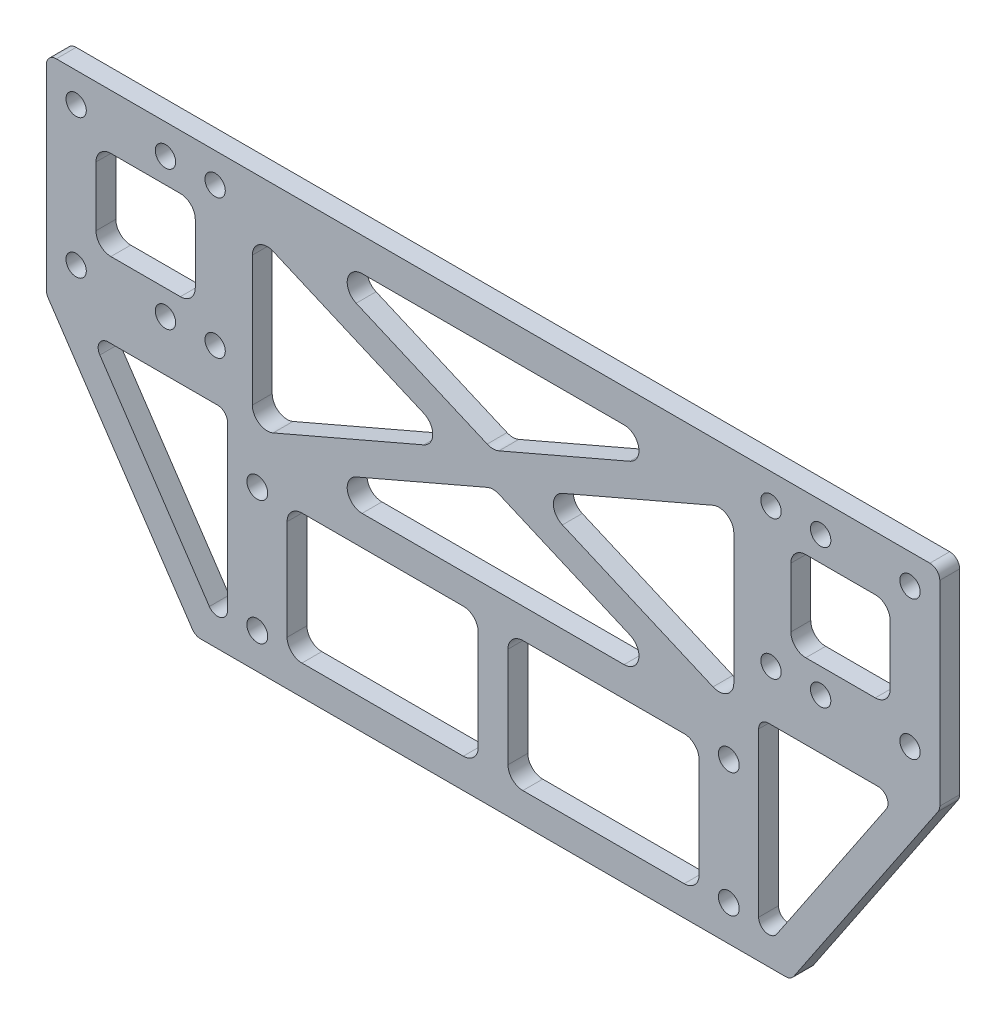
from build123d import *

# Parameters (mm, degrees)
SKETCH_1_W          = 120
SKETCH_1_H          = 95
EXTRUDE_1_DEPTH     = 4
SKETCH_2_R          = 2.1
CUT_EXTRUDE_1_DEPTH = 10
SKETCH_3_R          = 2.05
CUT_EXTRUDE_2_DEPTH = 10
SKETCH_4_W          = 180
SKETCH_4_H          = 50.32629385
SKETCH_4_R          = 2.05
EXTRUDE_2_DEPTH     = 4
EXTRUDE_3_DEPTH     = 4
CUT_EXTRUDE_3_DEPTH = 10
FILLET_1_R          = 2
SKETCH_7_R          = 2.05
CUT_EXTRUDE_4_DEPTH = 10
FILLET_2_R          = 2
SKETCH_8_W          = 20
SKETCH_8_H          = 18
CUT_EXTRUDE_5_DEPTH = 10
SKETCH_9_W          = 38.5
SKETCH_9_H          = 26.173706147
CUT_EXTRUDE_6_DEPTH = 10
FILLET_3_R          = 3
SKETCH_10_R         = 2.05
CUT_EXTRUDE_7_DEPTH = 10
SKETCH_11_W         = 180
SKETCH_11_H         = 15
CUT_EXTRUDE_8_DEPTH = 10
FILLET_4_R          = 2


with BuildPart() as part:
    # 草图1 → 凸台-拉伸1 (new body)
    with BuildSketch(Plane.XY):
        Rectangle(SKETCH_1_W, SKETCH_1_H)
    extrude(amount=EXTRUDE_1_DEPTH)

    # 草图2 → 切除-拉伸1 (cut)
    with BuildSketch(Plane(origin=(0, 0, 0), x_dir=(-1, 0, 0), z_dir=(0, 0, -1))):
        with Locations((47.5, -40.326293853)):
            Circle(SKETCH_2_R)
        with Locations((47.5, -15.326293853)):
            Circle(SKETCH_2_R)
        with Locations((-47.5, -15.326293853)):
            Circle(SKETCH_2_R)
        with Locations((-47.5, -40.326293853)):
            Circle(SKETCH_2_R)
    extrude(amount=-CUT_EXTRUDE_1_DEPTH, mode=Mode.SUBTRACT)

    # 草图3 → 切除-拉伸2 (cut)
    with BuildSketch(Plane(origin=(0, 0, 0), x_dir=(-1, 0, 0), z_dir=(0, 0, -1))):
        with Locations((56, 33.17370615)):
            Circle(SKETCH_3_R)
        with Locations((-56, 33.17370615)):
            Circle(SKETCH_3_R)
        with Locations((-56, 5.17370615)):
            Circle(SKETCH_3_R)
        with Locations((56, 5.17370615)):
            Circle(SKETCH_3_R)
    extrude(amount=-CUT_EXTRUDE_2_DEPTH, mode=Mode.SUBTRACT)

    # 草图4 → 凸台-拉伸2 (add)
    with BuildSketch(Plane(origin=(0, 0, 0), x_dir=(-1, 0, 0), z_dir=(0, 0, -1))):
        with Locations((0, 22.336853075)):
            Rectangle(SKETCH_4_W, SKETCH_4_H)
        with Locations((56, 5.17370615)):
            Circle(SKETCH_4_R, mode=Mode.SUBTRACT)
        with Locations((56, 33.17370615)):
            Circle(SKETCH_4_R, mode=Mode.SUBTRACT)
        with Locations((-56, 5.17370615)):
            Circle(SKETCH_4_R, mode=Mode.SUBTRACT)
        with Locations((-56, 33.17370615)):
            Circle(SKETCH_4_R, mode=Mode.SUBTRACT)
    extrude(amount=-EXTRUDE_2_DEPTH)

    # 草图5 → 凸台-拉伸3 (add)
    with BuildSketch(Plane(origin=(0, 0, 0), x_dir=(-1, 0, 0), z_dir=(0, 0, -1))):
        Polygon((-90, -2.82629385), (-60, -47.5), (-60, -2.82629385), align=None)
        Polygon((60, -47.5), (60, -2.82629385), (90, -2.82629385), align=None)
    extrude(amount=-EXTRUDE_3_DEPTH)

    # 草图6 → 切除-拉伸3 (cut)
    with BuildSketch(Plane.XY.offset(4)):
        Polygon((-81.312928752, -5), (-53.5, -5), (-53.5, -46.416886874), align=None)
        Polygon((53.5, -46.416886874), (81.312928752, -5), (53.5, -5), align=None)
    extrude(amount=-CUT_EXTRUDE_3_DEPTH, mode=Mode.SUBTRACT)

    # 圆角1
    fillet_1_edges = [part.edges().sort_by_distance(p)[0] for p in [
        (-53.5, -46.416886874, 2),
        (-81.312928752, -5, 2),
        (-53.5, -5, 2),
        (53.5, -46.416886874, 2),
        (53.5, -5, 2),
        (81.312928752, -5, 2),
    ]]
    fillet(fillet_1_edges, radius=FILLET_1_R)

    # 草图7 → 切除-拉伸4 (cut)
    with BuildSketch(Plane.XY.offset(4)):
        with Locations((-84, 33.17370615)):
            Circle(SKETCH_7_R)
        with Locations((-84, 5.17370615)):
            Circle(SKETCH_7_R)
        with Locations(Location((84, 33.17370615, 0), (0, 0, 180))):
            Circle(SKETCH_7_R)
        with Locations(Location((84, 5.17370615, 0), (0, 0, 180))):
            Circle(SKETCH_7_R)
    extrude(amount=-CUT_EXTRUDE_4_DEPTH, mode=Mode.SUBTRACT)

    # 圆角2
    fillet_2_edges = [part.edges().sort_by_distance(p)[0] for p in [
        (-90, -2.82629385, 2),
        (90, 47.5, 2),
        (-90, 47.5, 2),
        (90, -2.82629385, 2),
        (60, -47.5, 2),
        (-60, -47.5, 2),
    ]]
    fillet(fillet_2_edges, radius=FILLET_2_R)

    # 草图8 → 切除-拉伸5 (cut)
    with BuildSketch(Plane.XY.offset(4)):
        with Locations((-70, 19.17370615)):
            Rectangle(SKETCH_8_W, SKETCH_8_H)
        Polygon((-48.5, 29.232984165), (-48.5, -6.059278018), (-7.576586563, 11.586853073), align=None)
        Polygon((-40.923413437, 32.5), (0, 14.853868908), (40.923413437, 32.5), align=None)
        Polygon((48.5, 29.232984165), (7.576586563, 11.586853073), (48.5, -6.059278018), align=None)
        Polygon((0, 8.319837238), (-40.923413437, -9.326293853), (40.923413437, -9.326293853), align=None)
        with Locations((70, 19.17370615)):
            Rectangle(SKETCH_8_W, SKETCH_8_H)
    extrude(amount=-CUT_EXTRUDE_5_DEPTH, mode=Mode.SUBTRACT)

    # 草图9 → 切除-拉伸6 (cut)
    with BuildSketch(Plane.XY.offset(4)):
        with Locations((-22.25, -28.413146927)):
            Rectangle(SKETCH_9_W, SKETCH_9_H)
        with Locations((22.25, -28.413146927)):
            Rectangle(SKETCH_9_W, SKETCH_9_H)
    extrude(amount=-CUT_EXTRUDE_6_DEPTH, mode=Mode.SUBTRACT)

    # 圆角3
    fillet_3_edges = [part.edges().sort_by_distance(p)[0] for p in [
        (-60, 10.17370615, 2),
        (-80, 10.17370615, 2),
        (-80, 28.17370615, 2),
        (-60, 28.17370615, 2),
        (7.576586563, 11.586853073, 2),
        (48.5, 29.232984165, 2),
        (48.5, -6.059278018, 2),
        (-40.923413437, -9.326293853, 2),
        (0, 8.319837238, 2),
        (40.923413437, -9.326293853, 2),
        (-48.5, -6.059278018, 2),
        (-48.5, 29.232984165, 2),
        (-7.576586563, 11.586853073, 2),
        (0, 14.853868908, 2),
        (-40.923413437, 32.5, 2),
        (40.923413437, 32.5, 2),
        (80, 10.17370615, 2),
        (60, 10.17370615, 2),
        (60, 28.17370615, 2),
        (80, 28.17370615, 2),
        (-3, -15.326293853, 2),
        (-3, -41.5, 2),
        (-41.5, -41.5, 2),
        (-41.5, -15.326293853, 2),
        (3, -15.326293853, 2),
        (41.5, -15.326293853, 2),
        (41.5, -41.5, 2),
        (3, -41.5, 2),
    ]]
    fillet(fillet_3_edges, radius=FILLET_3_R)

    # 草图10 → 切除-拉伸7 (cut)
    with BuildSketch(Plane.XY.offset(4)):
        with Locations((-66, 33.17370615)):
            Circle(SKETCH_10_R)
        with Locations((-66, 5.17370615)):
            Circle(SKETCH_10_R)
        with Locations(Location((66, 5.17370615, 0), (0, 0, 180))):
            Circle(SKETCH_10_R)
        with Locations(Location((66, 33.17370615, 0), (0, 0, 180))):
            Circle(SKETCH_10_R)
    extrude(amount=-CUT_EXTRUDE_7_DEPTH, mode=Mode.SUBTRACT)

    # 草图11 → 切除-拉伸8 (cut)
    with BuildSketch(Plane.XY.offset(4)):
        with Locations((0, 46.67370615)):
            Rectangle(SKETCH_11_W, SKETCH_11_H)
    extrude(amount=-CUT_EXTRUDE_8_DEPTH, mode=Mode.SUBTRACT)

    # 圆角4
    fillet_4_edges = [part.edges().sort_by_distance(p)[0] for p in [
        (-90, 39.17370615, 2),
        (90, 39.17370615, 2),
    ]]
    fillet(fillet_4_edges, radius=FILLET_4_R)


solid = part.part
